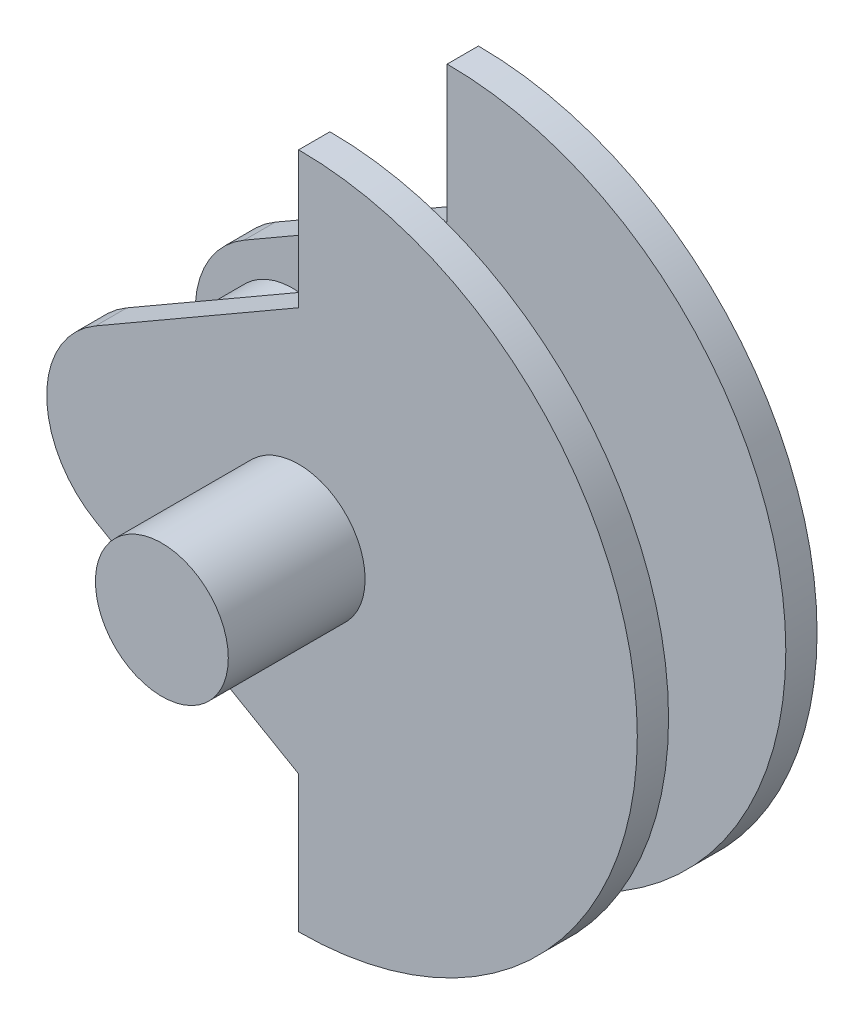
from build123d import *

# Parameters (mm, degrees)
BOSS_EXTRUDE1_DEPTH = 8
BOSS_EXTRUDE4_START = 30
BOSS_EXTRUDE4_DEPTH = 8
SKETCH7_R           = 17.223036208
BOSS_EXTRUDE5_DEPTH = 38
SKETCH8_R           = 17
BOSS_EXTRUDE6_DEPTH = 35
BOSS_EXTRUDE7_START = 35
SKETCH9_R           = 17
BOSS_EXTRUDE7_DEPTH = 35


with BuildPart() as part:
    # Sketch1 → Boss-Extrude1 (new body)
    with BuildSketch(Plane.XY):
        with BuildLine():
            Line((-12.5, 21.650635095), (39.461524227, 51.650635095))
            Line((39.461524227, 51.650635095), (39.461524227, 86.650635095))
            ThreePointArc((39.461524227, 86.650635095), (126.112159322, 0), (39.461524227, -86.650635095))
            Line((39.461524227, -86.650635095), (39.461524227, -51.650635095))
            Line((39.461524227, -51.650635095), (-12.5, -21.650635095))
            ThreePointArc((-12.5, -21.650635095), (-25, 0), (-12.5, 21.650635095))
        make_face()
    extrude(amount=BOSS_EXTRUDE1_DEPTH)



with BuildPart() as body_2:
    # Sketch5 → Boss-Extrude4 (new body)
    with BuildSketch(Plane(origin=(0, 0, 0), x_dir=(-1, 0, 0), z_dir=(0, 0, -1)).offset(BOSS_EXTRUDE4_START)):
        with BuildLine():
            Line((-39.461524227, 86.650635095), (-39.461524227, 51.650635095))
            Line((-39.461524227, 51.650635095), (12.5, 21.650635095))
            ThreePointArc((12.5, 21.650635095), (25, 0), (12.5, -21.650635095))
            Line((12.5, -21.650635095), (-39.461524227, -51.650635095))
            Line((-39.461524227, -51.650635095), (-39.461524227, -86.650635095))
            ThreePointArc((-39.461524227, -86.650635095), (-126.112159322, 0), (-39.461524227, 86.650635095))
        make_face()
    extrude(amount=BOSS_EXTRUDE4_DEPTH)


with BuildPart() as part_1:
    add(part.part)

    add(body_2.part)  # Boss-Extrude5 merges body 2
    # Sketch7 → Boss-Extrude5 (add)
    with BuildSketch(Plane.XY.offset(8)):
        Circle(SKETCH7_R)
    extrude(amount=-BOSS_EXTRUDE5_DEPTH)

    # Sketch8 → Boss-Extrude6 (add)
    with BuildSketch(Plane.XY.offset(8)):
        with Locations((39.461524227, 0)):
            Circle(SKETCH8_R)
    extrude(amount=BOSS_EXTRUDE6_DEPTH)

    # Sketch9 → Boss-Extrude7 (add)
    with BuildSketch(Plane(origin=(0, 0, -38), x_dir=(-1, 0, 0), z_dir=(0, 0, -1)).offset(BOSS_EXTRUDE7_START)):
        with Locations(Location((-39.461524227, 0, 0), (0, 0, 180))):
            Circle(SKETCH9_R)
    extrude(amount=-BOSS_EXTRUDE7_DEPTH)


solid = part_1.part
